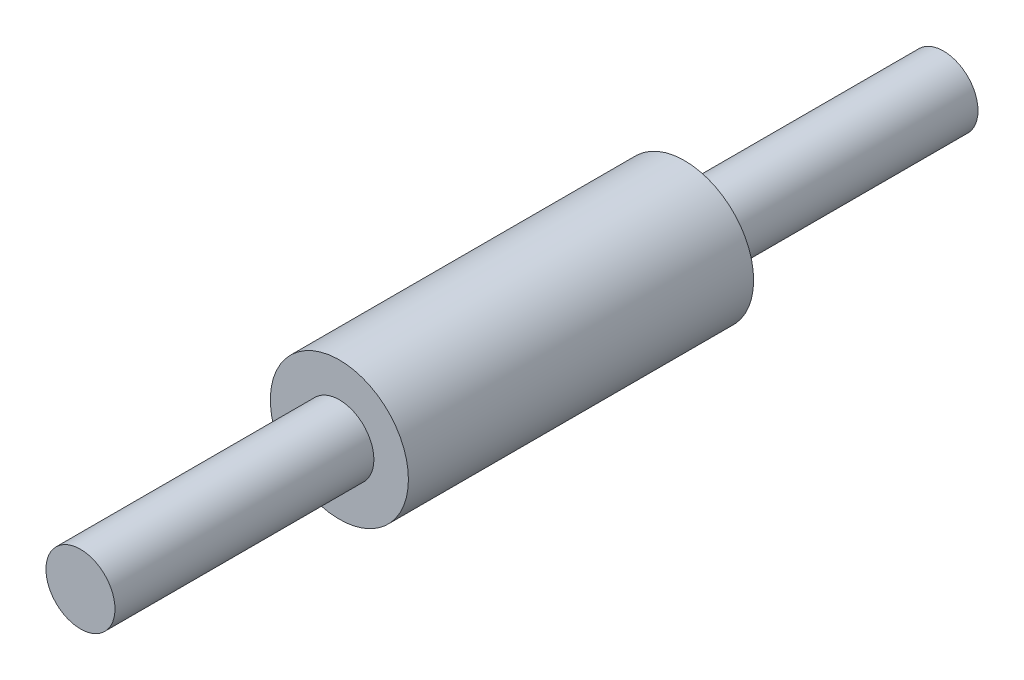
from build123d import *


with BuildPart() as part:
    # Esquisse2 → Révolution1 (revolve)
    with BuildSketch(Plane(origin=(0, 0, 0), x_dir=(1, 0, 0), z_dir=(0, 1, 0)), mode=Mode.PRIVATE) as r_volution1_sk:
        Polygon((-10, 125), (-10, 50), (-20, 50), (-20, -50), (-10, -50), (-10, -125), (0, -125), (0, 125), align=None)
    revolve(r_volution1_sk.sketch.rotate(Axis((0, 0, 125), (0, 0, -1)), 180), axis=Axis((0, 0, 125), (0, 0, -1)))


solid = part.part
